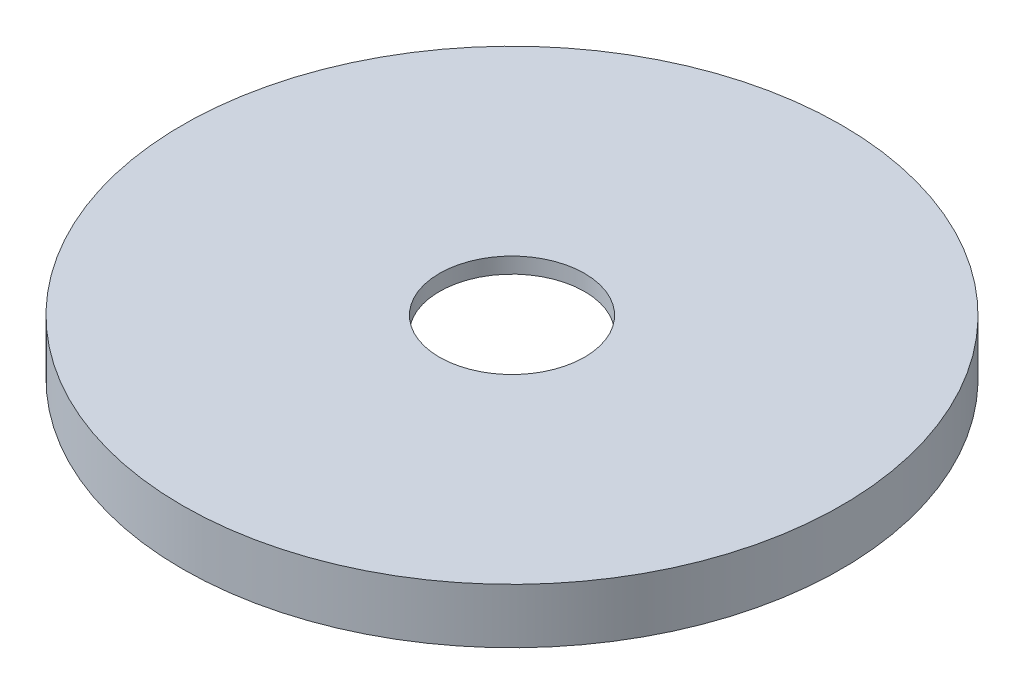
from build123d import *

# Parameters (mm, degrees)
CROQUIS1_R              = 84
CROQUIS1_R_2            = 82
SALIENTE_EXTRUIR1_DEPTH = 10
CROQUIS2_R              = 84
SALIENTE_EXTRUIR2_DEPTH = 4
CROQUIS3_R              = 1.5
SALIENTE_EXTRUIR3_DEPTH = 10
MATRIZC1_COUNT          = 4
CROQUIS15_R             = 83
CROQUIS15_R_2           = 82
CORTAR_EXTRUIR1_DEPTH   = 5
CROQUIS16_R             = 18.5
CORTAR_EXTRUIR2_DEPTH   = 13


with BuildPart() as part:
    # Croquis1 → Saliente-Extruir1 (new body)
    with BuildSketch(Plane(origin=(0, 0, 0), x_dir=(1, 0, 0), z_dir=(0, 1, 0))):
        Circle(CROQUIS1_R)
        Circle(CROQUIS1_R_2, mode=Mode.SUBTRACT)
    extrude(amount=SALIENTE_EXTRUIR1_DEPTH)

    # Croquis2 → Saliente-Extruir2 (add)
    with BuildSketch(Plane(origin=(0, 10, 0), x_dir=(1, 0, 0), z_dir=(0, 1, 0))):
        Circle(CROQUIS2_R)
    extrude(amount=SALIENTE_EXTRUIR2_DEPTH)

    # Croquis3 → Saliente-Extruir3 (add)
    with BuildSketch(Plane.XZ.offset(-10)):
        with Locations((-20, 40)):
            Circle(CROQUIS3_R)
    saliente_extruir3 = extrude(amount=SALIENTE_EXTRUIR3_DEPTH)

    # MatrizC1: Saliente-Extruir3 ×4 about axis
    matrizc1_axis = Axis((0, -0.7, 0), (0, 1, 0))
    for i in range(1, MATRIZC1_COUNT):
        add(saliente_extruir3.rotate(matrizc1_axis, i * 360 / MATRIZC1_COUNT))

    # Croquis15 → Cortar-Extruir1 (cut)
    with BuildSketch(Plane.XZ):
        Circle(CROQUIS15_R)
        Circle(CROQUIS15_R_2, mode=Mode.SUBTRACT)
    extrude(amount=-CORTAR_EXTRUIR1_DEPTH, mode=Mode.SUBTRACT)

    # Croquis16 → Cortar-Extruir2 (cut)
    with BuildSketch(Plane.XZ.offset(-10)):
        Circle(CROQUIS16_R)
    extrude(amount=-CORTAR_EXTRUIR2_DEPTH, mode=Mode.SUBTRACT)


solid = part.part
